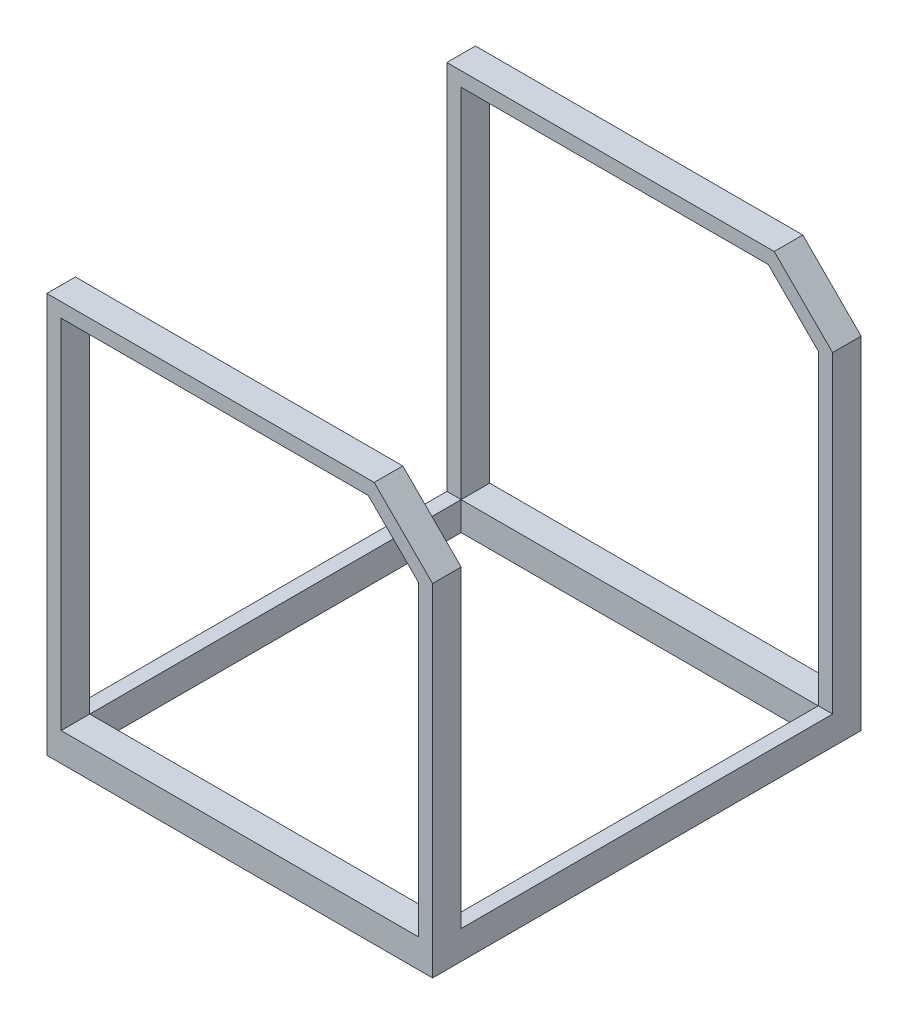
from build123d import *

# Parameters (mm, degrees)
BOSS_EXTRUDE1_DEPTH = 40
SKETCH2_W           = 20
SKETCH2_H           = 40
BOSS_EXTRUDE2_DEPTH = 520


with BuildPart() as part:
    # Sketch1 → Boss-Extrude1 (new body)
    with BuildSketch(Plane.XY):
        Polygon((0, 0), (0, 560), (458.284271247, 560), (540, 478.284271247), (540, 0), align=None)
        Polygon((20, 40), (20, 540), (450, 540), (520, 470), (520, 40), align=None, mode=Mode.SUBTRACT)
    boss_extrude1 = extrude(amount=BOSS_EXTRUDE1_DEPTH)

    # Sketch2 → Boss-Extrude2 (add)
    with BuildSketch(Plane.XY.offset(40)):
        with Locations((530, 20)):
            Rectangle(SKETCH2_W, SKETCH2_H)
        with Locations((10, 20)):
            Rectangle(SKETCH2_W, SKETCH2_H)
    extrude(amount=BOSS_EXTRUDE2_DEPTH)

    # Mirror1: Boss-Extrude1 across plane
    add(boss_extrude1.mirror(Plane(origin=(0, 0, 300), x_dir=(1, 0, 0), z_dir=(0, 0, -1))))


solid = part.part
